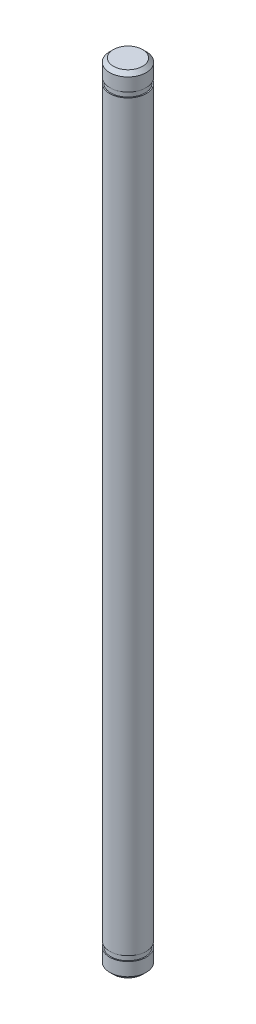
from build123d import *

# Parameters (mm, degrees)
SKETCH_1_R          = 2.5
EXTRUDE_1_DEPTH     = 108
CHAMFER_1_SIZE      = 0.5
CUT_EXTRUDE_START   = -3
SKETCH_2_R          = 2.5
SKETCH_2_R_2        = 2.35
CUT_EXTRUDE_1_DEPTH = 0.7


with BuildPart() as part:
    # 草图1 → 凸台-拉伸1 (new body)
    with BuildSketch(Plane(origin=(0, 0, 0), x_dir=(1, 0, 0), z_dir=(0, 1, 0))):
        with Locations(Location((0, 0, 0), (0, 0, 270))):
            Circle(SKETCH_1_R)
    extrude(amount=EXTRUDE_1_DEPTH)

    # 倒角1
    chamfer_1_edges = [part.edges().sort_by_distance(p)[0] for p in [
        (0, 0, -2.5),
        (0, 108, -2.5),
    ]]
    chamfer(chamfer_1_edges, length=CHAMFER_1_SIZE)

    # 草图2 → 切除-拉伸1 (cut)
    with BuildSketch(Plane(origin=(0, 108, 0), x_dir=(1, 0, 0), z_dir=(0, 1, 0)).offset(CUT_EXTRUDE_START)):
        with Locations(Location((0, 0, 0), (0, 0, 270))):
            Circle(SKETCH_2_R)
        with Locations(Location((0, 0, 0), (0, 0, 270))):
            Circle(SKETCH_2_R_2, mode=Mode.SUBTRACT)
    cut_extrude_1 = extrude(amount=CUT_EXTRUDE_1_DEPTH, mode=Mode.SUBTRACT)

    # 镜向1: 切除-拉伸1 across plane
    add(cut_extrude_1.mirror(Plane.ZX.offset(54)), mode=Mode.SUBTRACT)


solid = part.part
